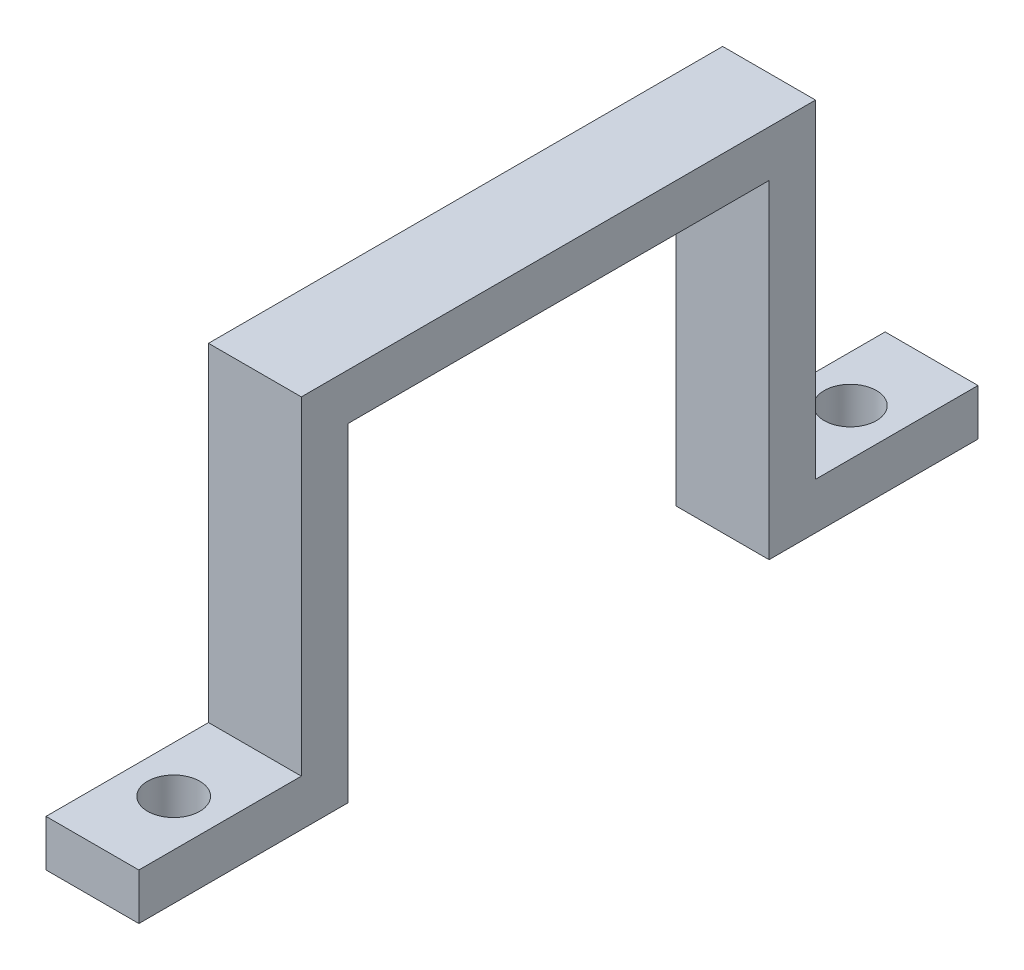
from build123d import *

# Parameters (mm, degrees)
STRAP_DEPTH        = 4
EAR_HOLES_M4_START = -0.5
SKETCH2_R          = 2.25
EAR_HOLES_M4_DEPTH = 5


with BuildPart() as part:
    # Sketch1 → Strap (new, symmetric)
    with BuildSketch(Plane(origin=(0, 0, 0), x_dir=(0, 0, -1), z_dir=(1, 0, 0))):
        Polygon((-36.15, 0), (-18.15, 0), (-18.15, 28.3), (18.15, 28.3), (18.15, 0), (36.15, 0), (36.15, 4), (22.15, 4), (22.15, 32.3), (-22.15, 32.3), (-22.15, 4), (-36.15, 4), align=None)
    extrude(amount=STRAP_DEPTH, both=True)

    # Sketch2 → Ear_Holes_M4 (cut)
    with BuildSketch(Plane(origin=(0, 0, 0), x_dir=(1, 0, 0), z_dir=(0, 1, 0)).offset(EAR_HOLES_M4_START)):
        with Locations(Location((0, 29.15, 0), (0, 0, 90))):
            Circle(SKETCH2_R)
        with Locations(Location((0, -29.15, 0), (0, 0, 90))):
            Circle(SKETCH2_R)
    extrude(amount=EAR_HOLES_M4_DEPTH, mode=Mode.SUBTRACT)


solid = part.part
